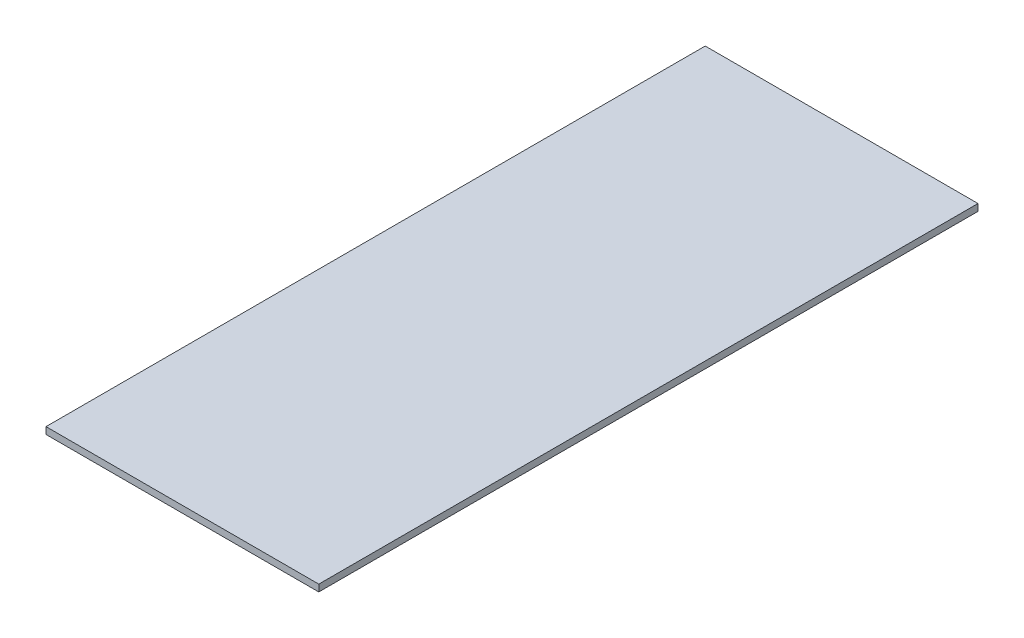
from build123d import *

# Parameters (mm, degrees)
SKETCH_1_W      = 120
SKETCH_1_H      = 290
EXTRUDE_1_DEPTH = 3


with BuildPart() as part:
    # 草图1 → 凸台-拉伸1 (new body)
    with BuildSketch(Plane(origin=(0, 0, 0), x_dir=(1, 0, 0), z_dir=(0, 1, 0))):
        with Locations((15.959528872, -99.652689966)):
            Rectangle(SKETCH_1_W, SKETCH_1_H)
    extrude(amount=EXTRUDE_1_DEPTH)


solid = part.part
